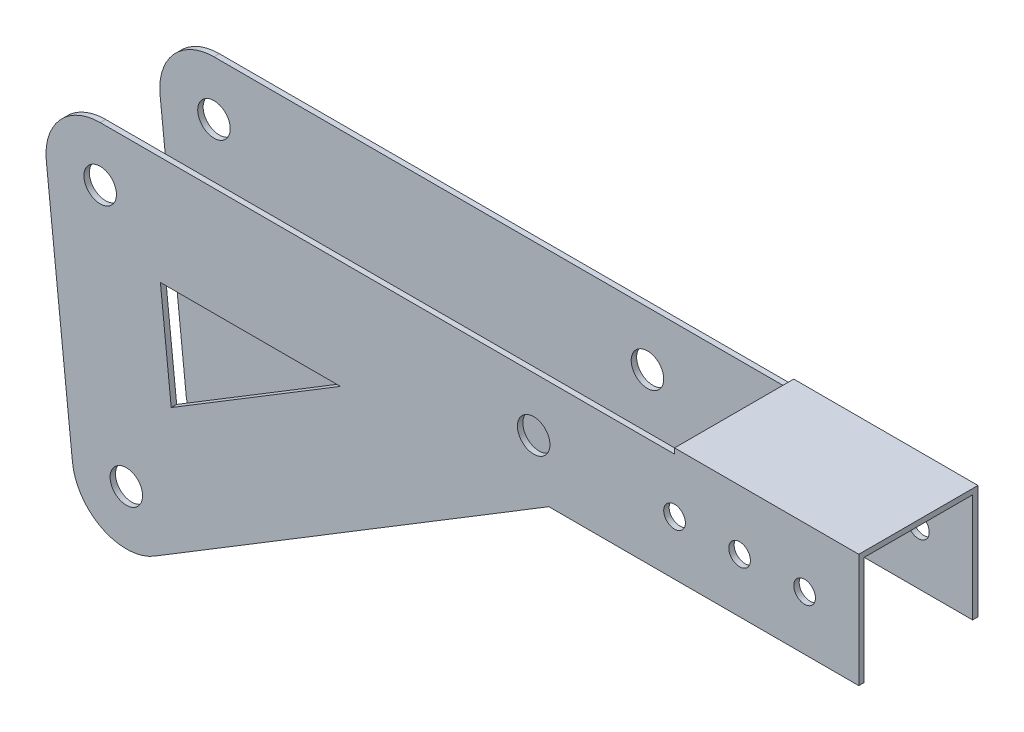
from build123d import *

# Parameters (mm, degrees)
SKETCH_1_R      = 1.5
SKETCH_1_R_2    = 1
EXTRUDE_1_DEPTH = 0.5
SKETCH_2_R      = 1.5
SKETCH_2_R_2    = 1
EXTRUDE_2_DEPTH = 0.5
SKETCH_3_W      = 17
SKETCH_3_H      = 11
EXTRUDE_3_DEPTH = 0.5


with BuildPart() as part:
    # 草图1 → 凸台-拉伸1 (new body)
    with BuildSketch(Plane.XY):
        with BuildLine():
            Line((-6.593488685, 8.462066188), (63.406511315, 8.462066188))
            Line((63.406511315, 8.462066188), (63.406511315, -1.537933812))
            Line((63.406511315, -1.537933812), (34.808265562, -1.537933812))
            Line((34.808265562, -1.537933812), (-1.581769944, -23.682365554))
            ThreePointArc((-1.581769944, -23.682365554), (-6.398586713, -23.892382087), (-9.153407147, -19.935515257))
            Line((-9.153407147, -19.935515257), (-11.565907147, 2.937609666))
            ThreePointArc((-11.565907147, 2.937609666), (-10.309823076, 6.807041329), (-6.593488685, 8.462066188))
        make_face()
        with Locations((-6.593488685, 3.462066188)):
            Circle(SKETCH_1_R, mode=Mode.SUBTRACT)
        with Locations((33.406511315, 3.462066188)):
            Circle(SKETCH_1_R, mode=Mode.SUBTRACT)
        with Locations((-4.180988685, -19.411058735)):
            Circle(SKETCH_1_R, mode=Mode.SUBTRACT)
        with Locations((58.406511315, 3.462066188)):
            Circle(SKETCH_1_R_2, mode=Mode.SUBTRACT)
        with Locations((52.406511315, 3.462066188)):
            Circle(SKETCH_1_R_2, mode=Mode.SUBTRACT)
        with Locations((46.406511315, 3.462066188)):
            Circle(SKETCH_1_R_2, mode=Mode.SUBTRACT)
        Polygon((-1.038388522, -1.537933812), (15.571716053, -1.537933812), (-0.03659159, -11.036058735), align=None, mode=Mode.SUBTRACT)
    extrude(amount=EXTRUDE_1_DEPTH)



with BuildPart() as body_2:
    # 草图2 → 凸台-拉伸2 (new body)
    with BuildSketch(Plane.XY.offset(-10)):
        with BuildLine():
            Line((-1.581769944, -23.682365554), (34.808265562, -1.537933812))
            Line((34.808265562, -1.537933812), (63.406511315, -1.537933812))
            Line((63.406511315, -1.537933812), (63.406511315, 8.462066188))
            Line((63.406511315, 8.462066188), (-6.593488685, 8.462066188))
            ThreePointArc((-6.593488685, 8.462066188), (-10.309823076, 6.807041329), (-11.565907147, 2.937609666))
            Line((-11.565907147, 2.937609666), (-9.153407147, -19.935515257))
            ThreePointArc((-9.153407147, -19.935515257), (-6.398586713, -23.892382087), (-1.581769944, -23.682365554))
        make_face()
        with Locations((-4.180988685, -19.411058735)):
            Circle(SKETCH_2_R, mode=Mode.SUBTRACT)
        with Locations((33.406511315, 3.462066188)):
            Circle(SKETCH_2_R, mode=Mode.SUBTRACT)
        with Locations((-6.593488685, 3.462066188)):
            Circle(SKETCH_2_R, mode=Mode.SUBTRACT)
        with Locations((52.406511315, 3.462066188)):
            Circle(SKETCH_2_R_2, mode=Mode.SUBTRACT)
        with Locations((58.406511315, 3.462066188)):
            Circle(SKETCH_2_R_2, mode=Mode.SUBTRACT)
        with Locations((46.406511315, 3.462066188)):
            Circle(SKETCH_2_R_2, mode=Mode.SUBTRACT)
        Polygon((-0.03659159, -11.036058735), (15.571716053, -1.537933812), (-1.038388522, -1.537933812), align=None, mode=Mode.SUBTRACT)
    extrude(amount=-EXTRUDE_2_DEPTH)


with BuildPart() as part_1:
    add(part.part)

    add(body_2.part)  # 凸台-拉伸3 merges body 2
    # 草图3 → 凸台-拉伸3 (add)
    with BuildSketch(Plane(origin=(0, 8.462066188, 0), x_dir=(1, 0, 0), z_dir=(0, 1, 0))):
        with Locations((54.906511315, 5)):
            Rectangle(SKETCH_3_W, SKETCH_3_H)
    extrude(amount=EXTRUDE_3_DEPTH)


solid = part_1.part
